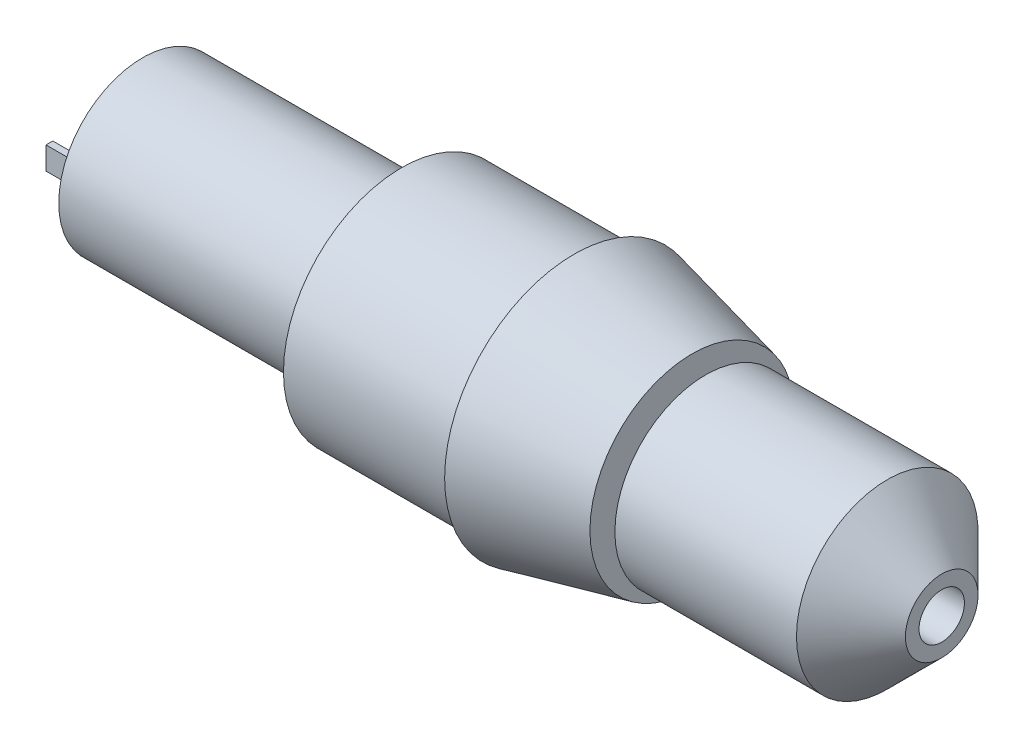
from build123d import *

# Parameters (mm, degrees)
SKETCH_2_W      = 1.5
SKETCH_2_H      = 5
EXTRUDE_1_DEPTH = 10


with BuildPart() as part:
    # Эскиз1 → Повернуть1 (revolve)
    with BuildSketch(Plane.XY, mode=Mode.PRIVATE) as revolve_1_sk:
        Polygon((0, 0), (0, 18.5), (57, 18.5), (57, 26), (95, 26), (95, 28.5), (121, 22.5), (121, 6), (124, 6), (124, 20), (164, 20), (176, 8), (176, 5), (166, 5), (166, 0), align=None)
    revolve(revolve_1_sk.sketch.rotate(Axis((0, 0, 0), (1, 0, 0)), 90), axis=Axis((0, 0, 0), (1, 0, 0)))

    # Эскиз2 → Бобышка-Вытянуть1 (add)
    with BuildSketch(Plane.ZY):
        with Locations((10.556652869, 0)):
            Rectangle(SKETCH_2_W, SKETCH_2_H)
        with Locations((-10.556652869, 0)):
            Rectangle(SKETCH_2_W, SKETCH_2_H)
    extrude(amount=EXTRUDE_1_DEPTH)


solid = part.part
